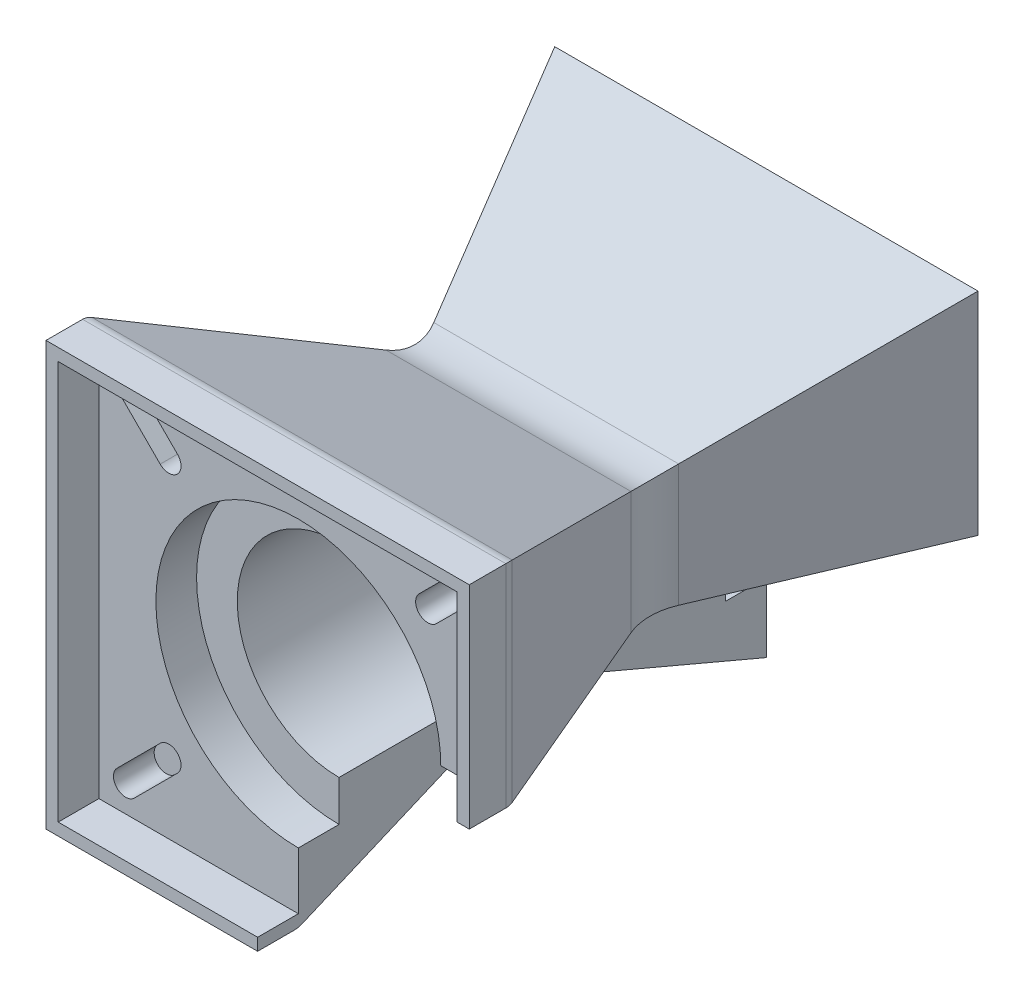
from build123d import *

# Parameters (mm, degrees)
SKETCH2_W           = 104
SKETCH2_H           = 104
BOSS_EXTRUDE1_DEPTH = 57.5
BOSS_EXTRUDE1_TAPER = 23
SKETCH3_R           = 25
CUT_EXTRUDE1_DEPTH  = 240.5
SKETCH5_W           = 52
SKETCH5_H           = 52
CUT_EXTRUDE2_DEPTH  = 240.5
SKETCH6_R           = 35
CUT_EXTRUDE3_DEPTH  = 10
CUT_EXTRUDE4_START  = -10
SKETCH7_R           = 35
CUT_EXTRUDE4_DEPTH  = 10
FILLET1_R           = 15
BOSS_EXTRUDE2_DEPTH = 10
CUT_EXTRUDE5_DEPTH  = 10
FILLET2_R           = 5


with BuildPart() as part:
    # Sketch2 → Boss-Extrude1 (new body)
    with BuildSketch(Plane.XY):
        Rectangle(SKETCH2_W, SKETCH2_H)
    boss_extrude1 = extrude(amount=BOSS_EXTRUDE1_DEPTH, taper=BOSS_EXTRUDE1_TAPER)

    # Mirror1: Boss-Extrude1 across plane
    add(boss_extrude1.mirror(Plane(origin=(0, 0, 57.5), x_dir=(1, 0, 0), z_dir=(0, 0, -1))))

    # Sketch3 → Cut-Extrude1 (cut)
    with BuildSketch(Plane.XY.offset(115)):
        Circle(SKETCH3_R)
    extrude(amount=-CUT_EXTRUDE1_DEPTH, mode=Mode.SUBTRACT)

    # Sketch5 → Cut-Extrude2 (cut)
    with BuildSketch(Plane.XY.offset(115)):
        with Locations((26, -26)):
            Rectangle(SKETCH5_W, SKETCH5_H)
    extrude(amount=-CUT_EXTRUDE2_DEPTH, mode=Mode.SUBTRACT)

    # Sketch6 → Cut-Extrude3 (cut)
    with BuildSketch(Plane.XY.offset(115)):
        Circle(SKETCH6_R)
    extrude(amount=-CUT_EXTRUDE3_DEPTH, mode=Mode.SUBTRACT)

    # Sketch7 → Cut-Extrude4 (cut)
    with BuildSketch(Plane(origin=(0, 0, 0), x_dir=(-1, 0, 0), z_dir=(0, 0, -1)).offset(CUT_EXTRUDE4_START)):
        Circle(SKETCH7_R)
    extrude(amount=CUT_EXTRUDE4_DEPTH, mode=Mode.SUBTRACT)

    # Fillet1
    fillet1_edges = [part.edges().sort_by_distance(p)[0] for p in [
        (-27.592698068, 0, 57.5),
        (-13.796349034, -27.592698068, 57.5),
        (27.592698068, 13.796349034, 57.5),
        (0, 27.592698068, 57.5),
    ]]
    fillet(fillet1_edges, radius=FILLET1_R)

    # Sketch8 → Boss-Extrude2 (add)
    with BuildSketch(Plane.XY.offset(115)):
        Polygon((0, -52), (-52, -52), (-52, 52), (52, 52), (52, 0), (49, 0), (49, 49), (-49, 49), (-49, -49), (0, -49), align=None)
    extrude(amount=BOSS_EXTRUDE2_DEPTH)

    # Sketch10 → Cut-Extrude5 (cut)
    with BuildSketch(Plane.XY.offset(115)):
        with BuildLine():
            Line((-40.305086528, 44.547727215), (-29.69848481, 33.941125497))
            ThreePointArc((-29.69848481, 33.941125497), (-29.69848481, 29.69848481), (-33.941125497, 29.69848481))
            Line((-33.941125497, 29.69848481), (-44.547727215, 40.305086528))
            ThreePointArc((-44.547727215, 40.305086528), (-44.547727215, 44.547727215), (-40.305086528, 44.547727215))
        make_face()
        with BuildLine():
            Line((44.547727215, 40.305086528), (33.941125497, 29.69848481))
            ThreePointArc((33.941125497, 29.69848481), (29.69848481, 29.69848481), (29.69848481, 33.941125497))
            Line((29.69848481, 33.941125497), (40.305086528, 44.547727215))
            ThreePointArc((40.305086528, 44.547727215), (44.547727215, 44.547727215), (44.547727215, 40.305086528))
        make_face()
        with BuildLine():
            Line((-44.547727215, -40.305086528), (-33.941125497, -29.69848481))
            ThreePointArc((-33.941125497, -29.69848481), (-29.69848481, -29.69848481), (-29.69848481, -33.941125497))
            Line((-29.69848481, -33.941125497), (-40.305086528, -44.547727215))
            ThreePointArc((-40.305086528, -44.547727215), (-44.547727215, -44.547727215), (-44.547727215, -40.305086528))
        make_face()
    extrude(amount=-CUT_EXTRUDE5_DEPTH, mode=Mode.SUBTRACT)

    # Fillet2
    fillet2_edges = [part.edges().sort_by_distance(p)[0] for p in [
        (0, 52, 115),
        (-52, 0, 115),
        (-26, -52, 115),
        (52, 26, 115),
    ]]
    fillet(fillet2_edges, radius=FILLET2_R)


solid = part.part
